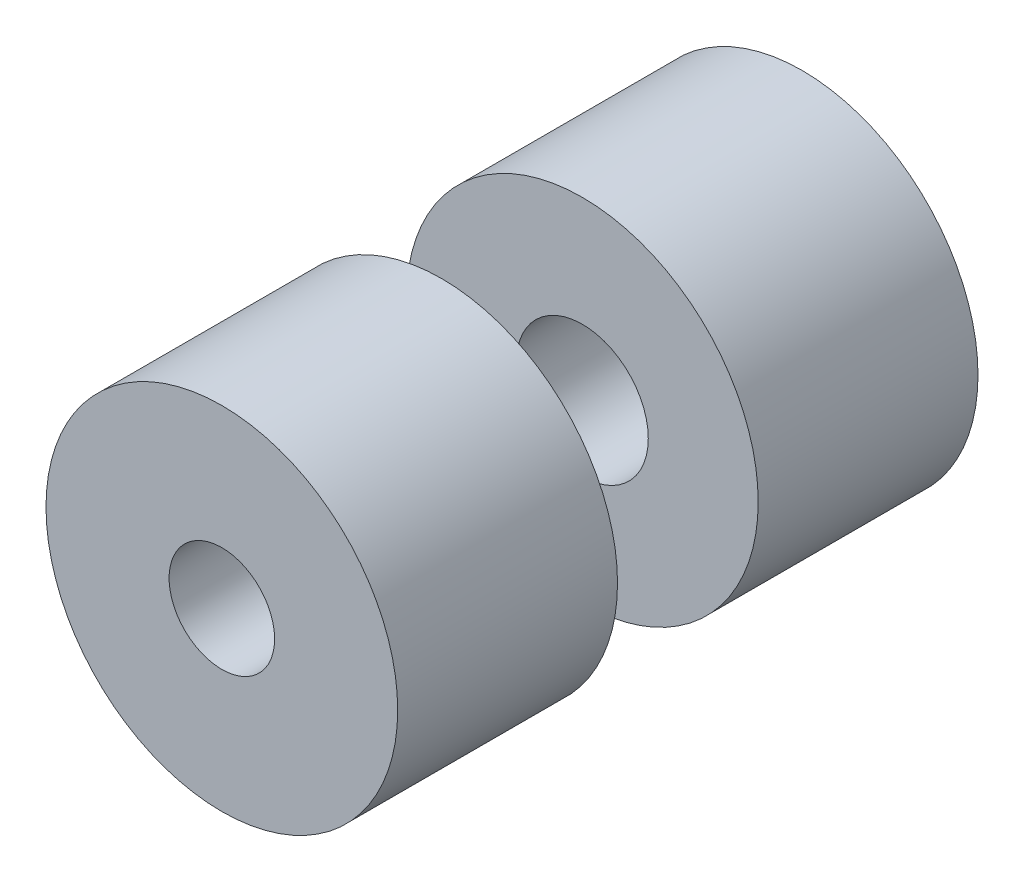
from build123d import *

# Parameters (mm, degrees)
SKETCH_1_W   = 25
SKETCH_1_H   = 14
SKETCH_1_H_2 = 12.5


with BuildPart() as part:
    # 草图1 → 旋转1 (revolve)
    with BuildSketch(Plane(origin=(0, 0, 0), x_dir=(0, 0, -1), z_dir=(1, 0, 0)), mode=Mode.PRIVATE) as revolve_1_sk:
        with Locations((26.5, 13)):
            Rectangle(SKETCH_1_W, SKETCH_1_H)
        with Locations((67.5, 13.75)):
            Rectangle(SKETCH_1_W, SKETCH_1_H_2)
    revolve(revolve_1_sk.sketch.rotate(Axis((0, 0, -9), (0, 0, -1)), 90), axis=Axis((0, 0, -9), (0, 0, -1)))


solid = part.part
